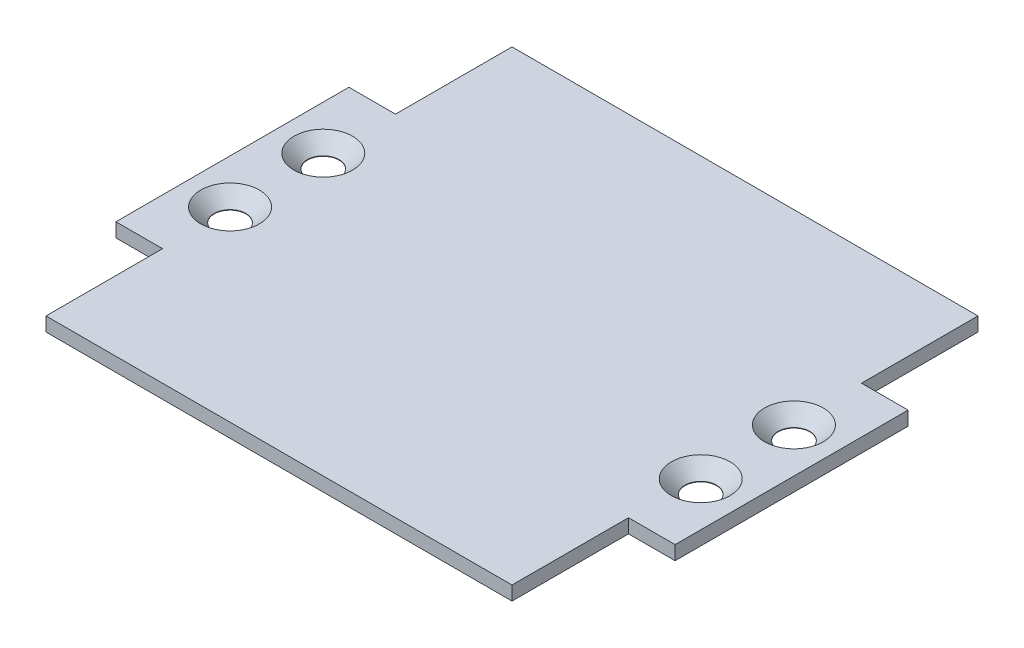
from build123d import *

# Parameters (mm, degrees)
SKETCH1_W                                    = 5
SKETCH1_H                                    = 25
SKETCH1_W_2                                  = 25
SKETCH1_H_2                                  = 50
BOSS_EXTRUDE1_DEPTH                          = 1.5
CSK_FOR_M3_COUNTERSUNK_FLAT_HEAD_SCR_2_COUNT = 2
CSK_FOR_M3_COUNTERSUNK_FLAT_HEAD_SCR_2_PITCH = 10
CSK_FOR_M3_COUNTERSUNK_FLAT_HEAD_SCR_3_COUNT = 2
CSK_FOR_M3_COUNTERSUNK_FLAT_HEAD_SCR_3_PITCH = 51.480578862
CSK_FOR_M3_COUNTERSUNK_FLAT_HEAD_SCR_4_COUNT = 2
CSK_FOR_M3_COUNTERSUNK_FLAT_HEAD_SCR_4_PITCH = 50.5


with BuildPart() as part:
    # Sketch1 → Boss-Extrude1 (new body)
    with BuildSketch(Plane(origin=(0, 0, 0), x_dir=(1, 0, 0), z_dir=(0, 1, 0))):
        Polygon((12.5, 25), (-12.5, 25), (-12.5, -25), (12.5, -25), (12.5, -12.5), (12.5, 12.5), align=None)
        with Locations((15, 0)):
            Rectangle(SKETCH1_W, SKETCH1_H)
        with Locations((-25, 0)):
            Rectangle(SKETCH1_W_2, SKETCH1_H_2)
        with Locations((-40, 0)):
            Rectangle(SKETCH1_W, SKETCH1_H)
    extrude(amount=BOSS_EXTRUDE1_DEPTH)

    # Sketch3 → CSK for M3 Countersunk Flat Head Screw1 (revolve, cut)
    with BuildSketch(Plane(origin=(12.75, 1.5, 5), x_dir=(0, 0, 1), z_dir=(1, 0, 0))):
        Polygon((0, 0), (0, 1.5), (1.7, 1.5), (1.7, 1.45), (3.15, 0), align=None)
    csk_for_m3_countersunk_flat_head_screw1 = revolve(axis=Axis((12.75, 7.85, 5), (0, -1, 0)), mode=Mode.SUBTRACT)

    # CSK for M3 Countersunk Flat Head Scr 2: CSK for M3 Countersunk Flat Head Screw1 ×2
    with Locations(*[(0, 0, -i * CSK_FOR_M3_COUNTERSUNK_FLAT_HEAD_SCR_2_PITCH) for i in range(1, CSK_FOR_M3_COUNTERSUNK_FLAT_HEAD_SCR_2_COUNT)]):
        add(csk_for_m3_countersunk_flat_head_screw1, mode=Mode.SUBTRACT)

    # CSK for M3 Countersunk Flat Head Scr 3: CSK for M3 Countersunk Flat Head Screw1 ×2
    with Locations(*[Vector(-0.9809524507300751, 0, -0.19424801004555947) * (i * CSK_FOR_M3_COUNTERSUNK_FLAT_HEAD_SCR_3_PITCH) for i in range(1, CSK_FOR_M3_COUNTERSUNK_FLAT_HEAD_SCR_3_COUNT)]):
        add(csk_for_m3_countersunk_flat_head_screw1, mode=Mode.SUBTRACT)

    # CSK for M3 Countersunk Flat Head Scr 4: CSK for M3 Countersunk Flat Head Screw1 ×2
    with Locations(*[(-i * CSK_FOR_M3_COUNTERSUNK_FLAT_HEAD_SCR_4_PITCH, 0, 0) for i in range(1, CSK_FOR_M3_COUNTERSUNK_FLAT_HEAD_SCR_4_COUNT)]):
        add(csk_for_m3_countersunk_flat_head_screw1, mode=Mode.SUBTRACT)


solid = part.part
